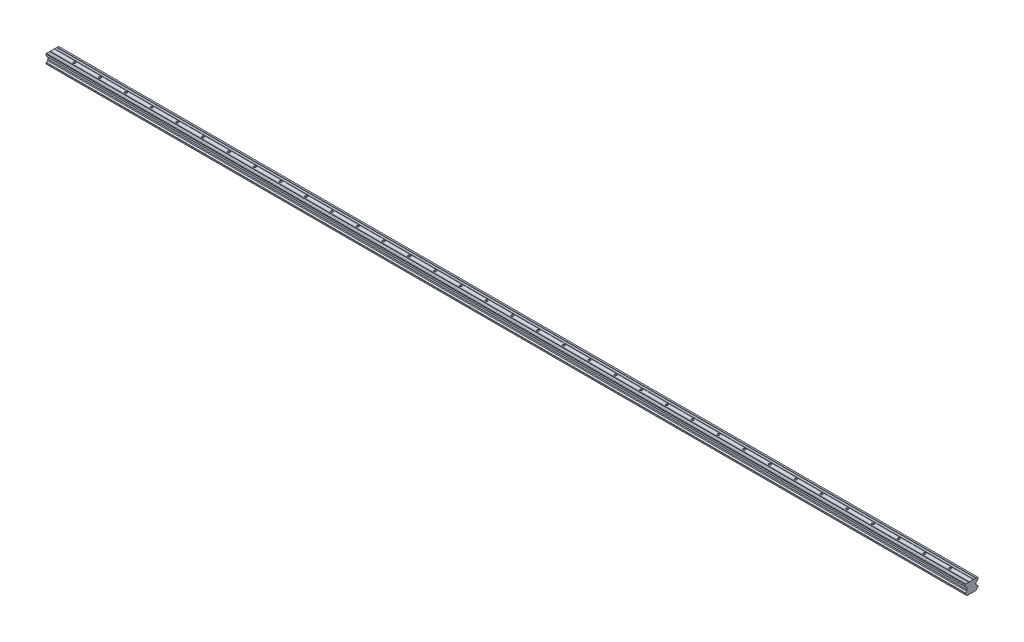
from build123d import *

# Parameters (mm, degrees)
BOSS_EXTRUDE1_DEPTH = 1427
HOLE1_D             = 3.5
HOLE1_CBORE_D       = 6
HOLE1_CBORE_DEPTH   = 4.5
LPATTERN1_COUNT     = 35
LPATTERN1_PITCH     = 40


with BuildPart() as part:
    # Sketch1 → Boss-Extrude1 (new body)
    with BuildSketch(Plane(origin=(0, 0, 0), x_dir=(0, 0, -1), z_dir=(1, 0, 0))):
        with BuildLine():
            Line((-7.965754986, -7.693975449), (-7.266272068, -8.393458366))
            Line((-7.266272068, -8.393458366), (7.266272068, -8.393458366))
            Line((7.266272068, -8.393458366), (7.965754986, -7.693975449))
            ThreePointArc((7.965754986, -7.693975449), (8.474723757, -6.421557866), (9.747437917, -5.913331162))
            Line((9.747437917, -5.913331162), (10.000000437, -5.660768637))
            Line((10.000000437, -5.660768637), (10.000000437, -3.788406023))
            Line((10.000000437, -3.788406023), (9.747437912, -3.535843503))
            ThreePointArc((9.747437912, -3.535843503), (8.462742055, -3.016656911), (7.965755402, -1.72321096))
            Line((7.965755402, -1.72321096), (7.005148341, -0.762603918))
            Line((7.005148341, -0.762603918), (7.005148341, 2.166206023))
            Line((7.005148341, 2.166206023), (10.000000347, 5.161058089))
            Line((10.000000347, 5.161058089), (10.000000347, 7.712387211))
            Line((10.000000347, 7.712387211), (9.408464779, 8.393458268))
            Line((9.408464779, 8.393458268), (7.133016457, 8.393458268))
            Line((7.133016457, 8.393458268), (6.789534443, 8.049976247))
            Line((6.789534443, 8.049976247), (4.271139656, 8.049976247))
            Line((4.271139656, 8.049976247), (3.927707784, 8.393458265))
            Line((3.927707784, 8.393458265), (3.061282509, 8.393458265))
            Line((3.061282509, 8.393458265), (2.872049327, 8.204225079))
            Line((2.872049327, 8.204225079), (-2.87204886, 8.204225079))
            Line((-2.87204886, 8.204225079), (-3.061282046, 8.393458261))
            Line((-3.061282046, 8.393458261), (-3.927707321, 8.393458261))
            Line((-3.927707321, 8.393458261), (-4.271189216, 8.049976359))
            Line((-4.271189216, 8.049976359), (-6.789534095, 8.049976359))
            Line((-6.789534095, 8.049976359), (-7.133016116, 8.393458373))
            Line((-7.133016116, 8.393458373), (-9.30771733, 8.393458373))
            Line((-9.30771733, 8.393458373), (-10, 7.70117569))
            Line((-10, 7.70117569), (-10, 5.161058187))
            Line((-10, 5.161058187), (-7.005147934, 2.166206181))
            Line((-7.005147934, 2.166206181), (-7.005147934, -0.76260376))
            Line((-7.005147934, -0.76260376), (-7.965754986, -1.723210812))
            ThreePointArc((-7.965754986, -1.723210812), (-8.462741848, -3.016656549), (-9.747437477, -3.535843372))
            Line((-9.747437477, -3.535843372), (-10, -3.788405895))
            Line((-10, -3.788405895), (-10, -5.660768509))
            Line((-10, -5.660768509), (-9.747437477, -5.913331032))
            ThreePointArc((-9.747437477, -5.913331032), (-8.474723558, -6.421557943), (-7.965754986, -7.693975449))
        make_face()
    extrude(amount=BOSS_EXTRUDE1_DEPTH)

    # Hole1 (through all)
    with Locations(Plane(origin=(34, -8.393458366, 0), x_dir=(0, 0, -1), z_dir=(0, -1, 0))):
        with Locations((0, 0)):
            hole1 = CounterBoreHole(HOLE1_D / 2, HOLE1_CBORE_D / 2, HOLE1_CBORE_DEPTH)

    # LPattern1: Hole1 ×35
    with Locations(*[(i * LPATTERN1_PITCH, 0, 0) for i in range(1, LPATTERN1_COUNT)]):
        add(hole1, mode=Mode.SUBTRACT)


solid = part.part
